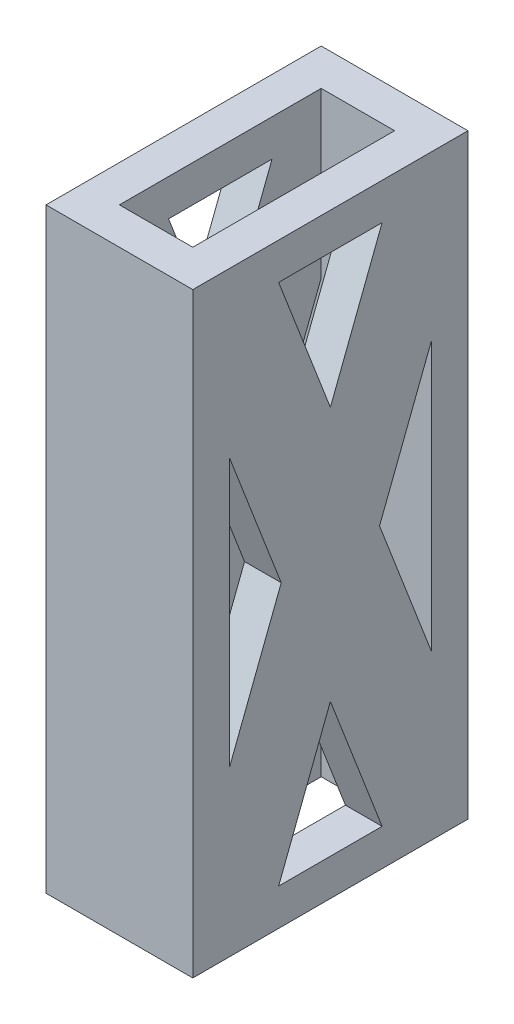
from build123d import *

# Parameters (mm, degrees)
SKETCH1_W           = 8
SKETCH1_H           = 15
SKETCH1_W_2         = 4
SKETCH1_H_2         = 11
BOSS_EXTRUDE1_DEPTH = 32.5
CUT_EXTRUDE1_DEPTH  = 37.67764987


with BuildPart() as part:
    # Sketch1 → Boss-Extrude1 (new body)
    with BuildSketch(Plane(origin=(0, 0, 0), x_dir=(1, 0, 0), z_dir=(0, 1, 0))):
        with Locations((4, -7.5)):
            Rectangle(SKETCH1_W, SKETCH1_H)
        with Locations((4, -7.5)):
            Rectangle(SKETCH1_W_2, SKETCH1_H_2, mode=Mode.SUBTRACT)
    extrude(amount=BOSS_EXTRUDE1_DEPTH)

    # Sketch2 → Cut-Extrude1 (cut, through all)
    with BuildSketch(Plane(origin=(8, 0, 0), x_dir=(0, 0, -1), z_dir=(1, 0, 0))):
        Polygon((-10.320250812, 30.5), (-4.679749188, 30.5), (-7.5, 23.192986532), align=None)
        Polygon((-13, 23.557013468), (-10.179749188, 16.25), (-13, 8.942986532), align=None)
        Polygon((-2, 23.557013468), (-4.820250812, 16.25), (-2, 8.942986532), align=None)
        Polygon((-7.5, 9.307013468), (-4.679749188, 2), (-10.320250812, 2), align=None)
    extrude(amount=-CUT_EXTRUDE1_DEPTH, mode=Mode.SUBTRACT)


solid = part.part
